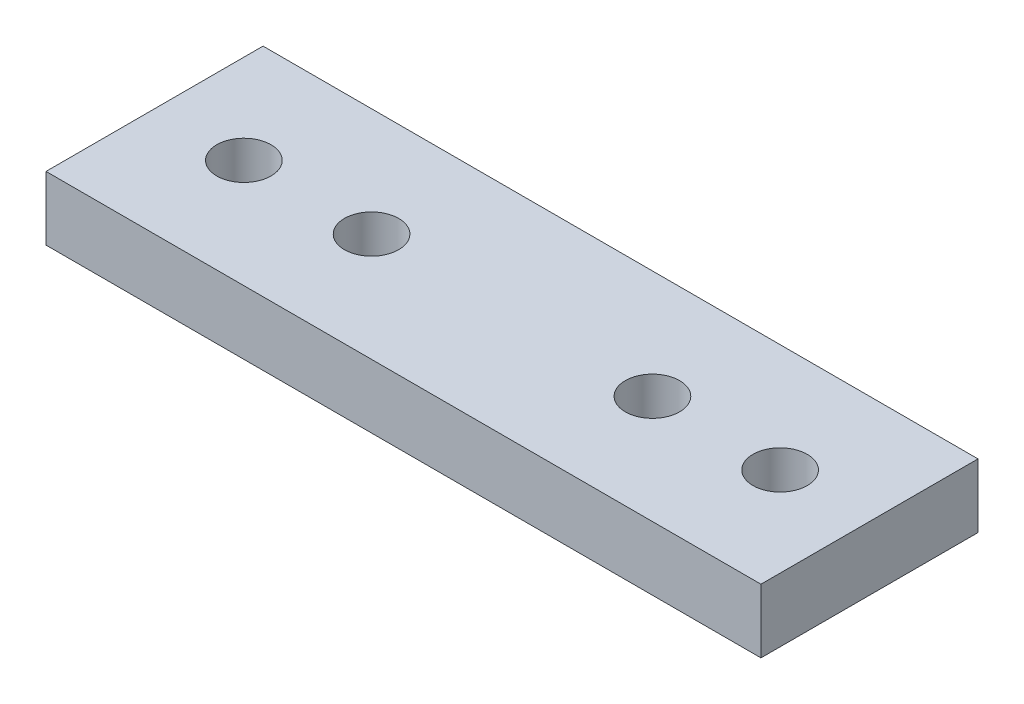
from build123d import *

# Parameters (mm, degrees)
SKETCH1_W           = 112
SKETCH1_H           = 34
SKETCH1_R           = 4.25
PLATE_EXTRUDE_DEPTH = 10


with BuildPart() as part:
    # Sketch1 → Plate_Extrude (new body)
    with BuildSketch(Plane(origin=(0, 0, 0), x_dir=(1, 0, 0), z_dir=(0, 1, 0))):
        Rectangle(SKETCH1_W, SKETCH1_H)
        with Locations(Location((-42, 0, 0), (0, 0, 270))):
            Circle(SKETCH1_R, mode=Mode.SUBTRACT)
        with Locations(Location((42, 0, 0), (0, 0, 270))):
            Circle(SKETCH1_R, mode=Mode.SUBTRACT)
        with Locations(Location((-22, 0, 0), (0, 0, 270))):
            Circle(SKETCH1_R, mode=Mode.SUBTRACT)
        with Locations(Location((22, 0, 0), (0, 0, 270))):
            Circle(SKETCH1_R, mode=Mode.SUBTRACT)
    extrude(amount=PLATE_EXTRUDE_DEPTH)


solid = part.part
